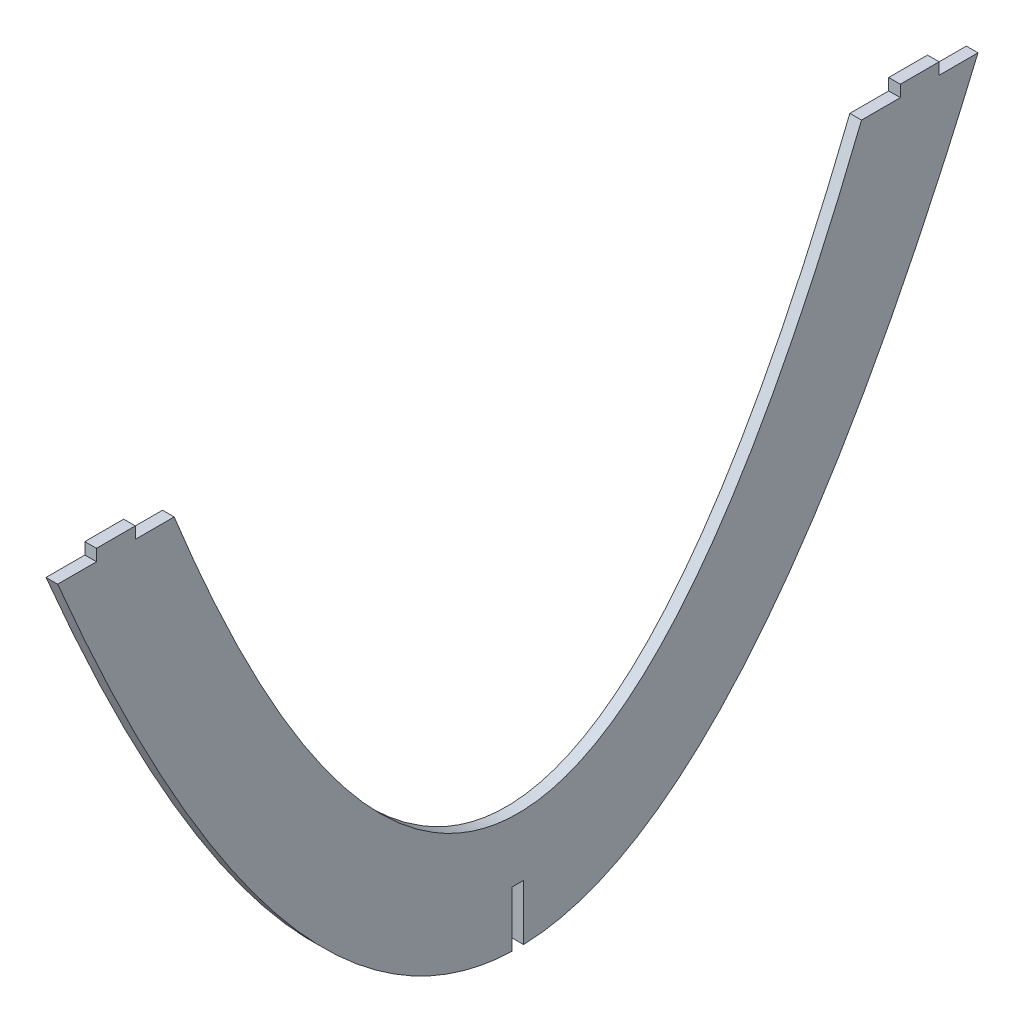
from build123d import *

# Parameters (mm, degrees)
EXTRUDE_1_DEPTH     = 3
EXTRUDE_2_DEPTH     = 3
CUT_EXTRUDE_1_DEPTH = 194.541958544


with BuildPart() as part:
    # 草图1 → 凸台-拉伸1 (new body)
    with BuildSketch(Plane(origin=(0, 0, 0), x_dir=(0, 0, -1), z_dir=(1, 0, 0))):
        with BuildLine():
            Line((-118.4910594, 150.001171578), (-88.491527969, 150.001171578))
            add(Edge.make_bspline(
                [(-88.491527969, 150.001171578), (0, -70.801451578), (88.491527969, 150.001171578)],
                knots=[0.163916292, 0.163916292, 0.163916292, 0.836083708, 0.836083708, 0.836083708], degree=2))
            Line((88.491527969, 150.001171578), (118.4910594, 150.001171578))
            add(Edge.make_bspline(
                [(-118.4910594, 150.001171578), (0, -130.801451578), (118.4910594, 150.001171578)],
                knots=[0.053698709, 0.053698709, 0.053698709, 0.946301291, 0.946301291, 0.946301291], degree=2))
        make_face()
    extrude(amount=EXTRUDE_1_DEPTH)

    # 草图2 → 凸台-拉伸2 (add)
    with BuildSketch(Plane(origin=(0, 150.001171578, 0), x_dir=(1, 0, 0), z_dir=(0, 1, 0))):
        Polygon((0, 98.491293685), (0.99999219, 98.491293685), (2.00000781, 108.491293685), (0, 108.491293685), align=None)
        Polygon((2.00000781, 108.491293685), (0.99999219, 98.491293685), (3, 98.491293685), (3, 108.491293685), align=None)
        Polygon((2.00000781, -98.491293685), (0.99999219, -108.491293685), (3, -108.491293685), (3, -98.491293685), align=None)
        Polygon((0, -108.491293685), (0.99999219, -108.491293685), (2.00000781, -98.491293685), (0, -98.491293685), align=None)
    extrude(amount=EXTRUDE_2_DEPTH)

    # 草图3 → 切除-拉伸1 (cut, through all)
    with BuildSketch(Plane.ZY):
        with BuildLine():
            Line((1.5, 23.967667099), (-1.5, 23.967667099))
            Line((-1.5, 23.967667099), (-1.5, 9.62236))
            add(Edge.make_bspline(
                [(-1.5, 9.62236), (0, 9.57736), (1.5, 9.62236)],
                knots=[0.49435019, 0.49435019, 0.49435019, 0.50564981, 0.50564981, 0.50564981], degree=2))
            Line((1.5, 9.62236), (1.5, 23.967667099))
        make_face()
    extrude(amount=-CUT_EXTRUDE_1_DEPTH, mode=Mode.SUBTRACT)


solid = part.part
